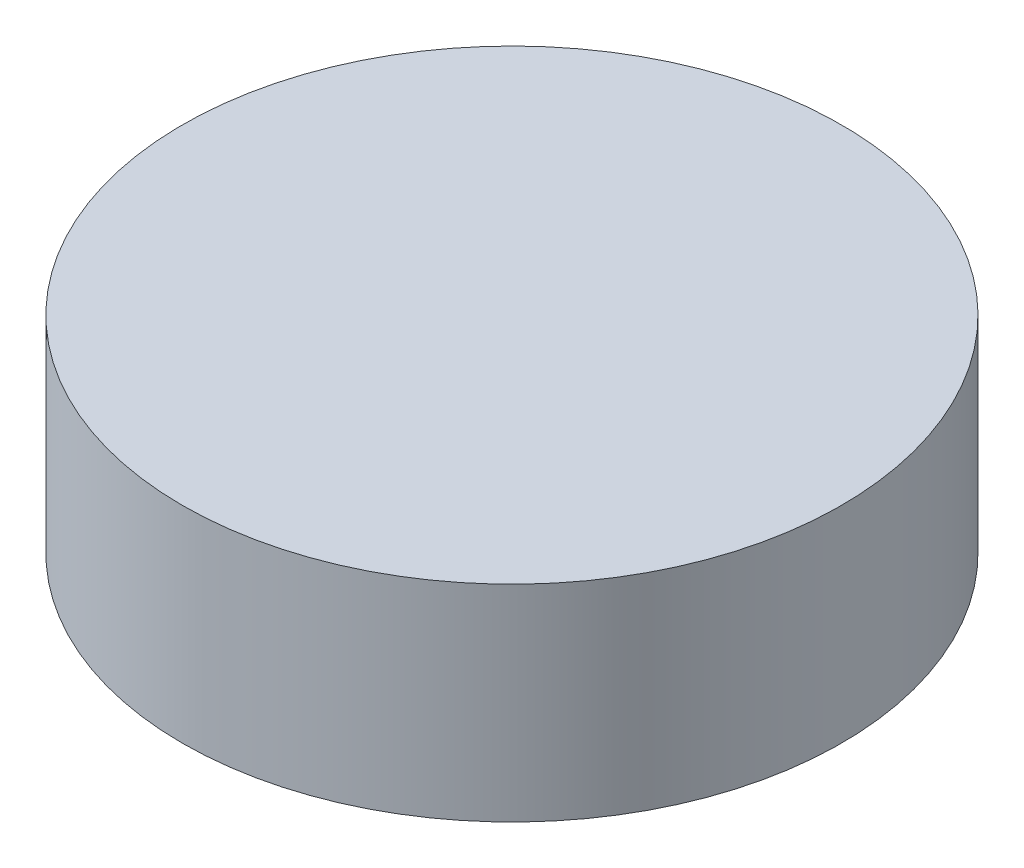
from build123d import *

# Parameters (mm, degrees)
SKETCH2_R           = 28.575
BOSS_EXTRUDE1_DEPTH = 17.859375
SHELL1_T            = -2.54


with BuildPart() as part:
    # Sketch2 → Boss-Extrude1 (new body)
    with BuildSketch(Plane(origin=(0, 0, 0), x_dir=(1, 0, 0), z_dir=(0, 1, 0))):
        with Locations(Location((0, 0, 0), (0, 0, 270))):
            Circle(SKETCH2_R)
    extrude(amount=BOSS_EXTRUDE1_DEPTH)

    # Shell1
    shell1_openings = [part.faces().sort_by_distance(p)[0] for p in [
        (0, 0, 0),
    ]]
    offset(amount=SHELL1_T, openings=shell1_openings, kind=Kind.INTERSECTION)


solid = part.part
